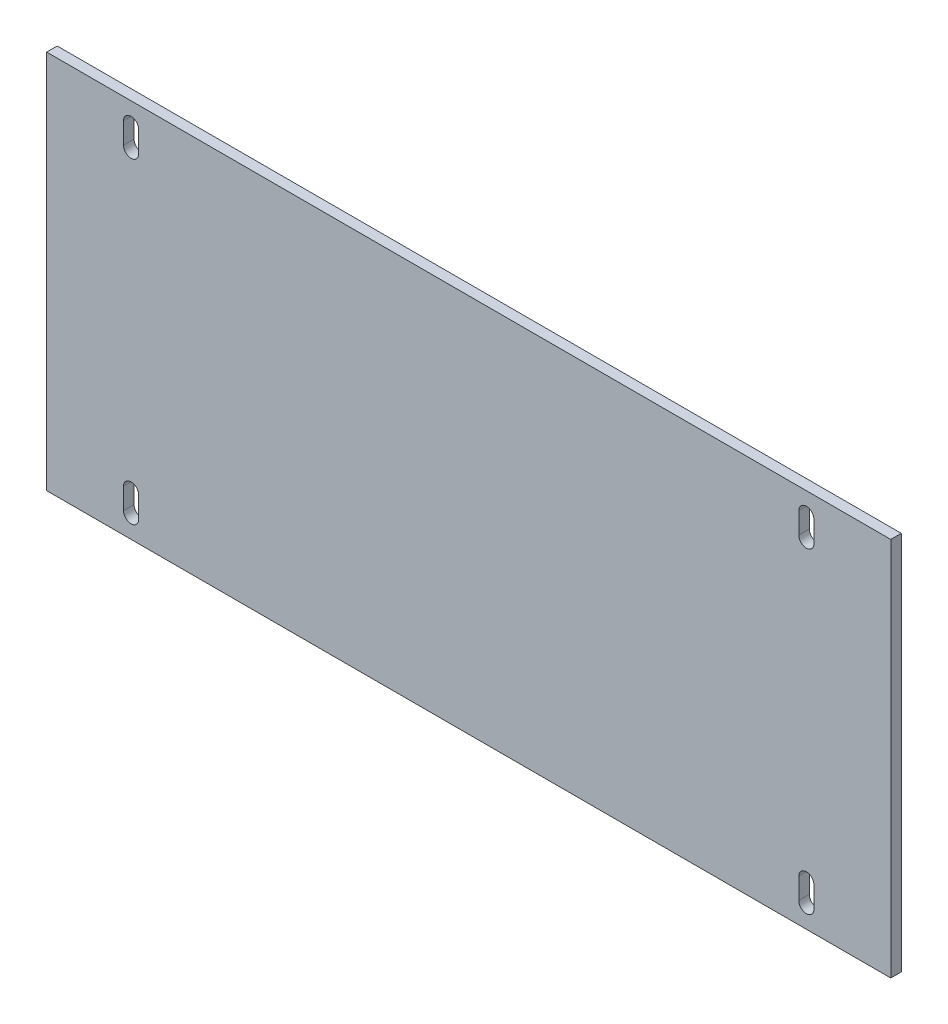
from build123d import *

# Parameters (mm, degrees)
SKETCH2_W                                = 400
SKETCH2_H                                = 180
BOSS_EXTRUDE1_DEPTH                      = 5
CUT_EXTRUDE1_REACH                       = 221.374
MIRROR1_AT_THE_SECOND_PLANE_COPY_1_REACH = 221.374


with BuildPart() as part:
    # Sketch2 → Boss-Extrude1 (new body)
    with BuildSketch(Plane.XY):
        Rectangle(SKETCH2_W, SKETCH2_H)
    extrude(amount=BOSS_EXTRUDE1_DEPTH)

    # Sketch3 → Cut-Extrude1 (cut, up to next)
    with BuildSketch(Plane.XY.offset(5), mode=Mode.PRIVATE) as cut_extrude1_sk1:
        with BuildLine():
            Line((-156.4, 80), (-156.4, 70))
            ThreePointArc((-156.4, 70), (-160, 66.4), (-163.6, 70))
            Line((-163.6, 70), (-163.6, 80))
            ThreePointArc((-163.6, 80), (-160, 83.6), (-156.4, 80))
        make_face()
    cut_extrude1_tool1 = extrude(cut_extrude1_sk1.sketch, amount=-CUT_EXTRUDE1_REACH, mode=Mode.PRIVATE) & part.part
    cut_extrude1 = cut_extrude1_tool1.solids().sort_by_distance((-160, 75, 5))[0]
    add(cut_extrude1, mode=Mode.SUBTRACT)

    # Mirror1: Cut-Extrude1 across plane
    add(cut_extrude1.mirror(Plane.ZX), mode=Mode.SUBTRACT)

    # Mirror1 at the second plane: Cut-Extrude1 across plane
    add(cut_extrude1.mirror(Plane(origin=(0, 0, 0), x_dir=(0, 0, 1), z_dir=(1, 0, 0))), mode=Mode.SUBTRACT)

    # Mirror1 at the second plane copy 1 sketc → Mirror1 at the second plane copy 1 (cut, up to next)
    with BuildSketch(Plane(origin=(0, 0, 5), x_dir=(-1, 0, 0), z_dir=(0, 0, 1)), mode=Mode.PRIVATE) as mirror1_at_the_second_plane_copy_1_sk1:
        with BuildLine():
            Line((-156.4, 80), (-156.4, 70))
            ThreePointArc((-156.4, 70), (-160, 66.4), (-163.6, 70))
            Line((-163.6, 70), (-163.6, 80))
            ThreePointArc((-163.6, 80), (-160, 83.6), (-156.4, 80))
        make_face()
    mirror1_at_the_second_plane_copy_1_tool1 = extrude(mirror1_at_the_second_plane_copy_1_sk1.sketch, amount=-MIRROR1_AT_THE_SECOND_PLANE_COPY_1_REACH, mode=Mode.PRIVATE) & part.part
    add(mirror1_at_the_second_plane_copy_1_tool1.solids().sort_by_distance((160, -75, 5))[0], mode=Mode.SUBTRACT)


solid = part.part
